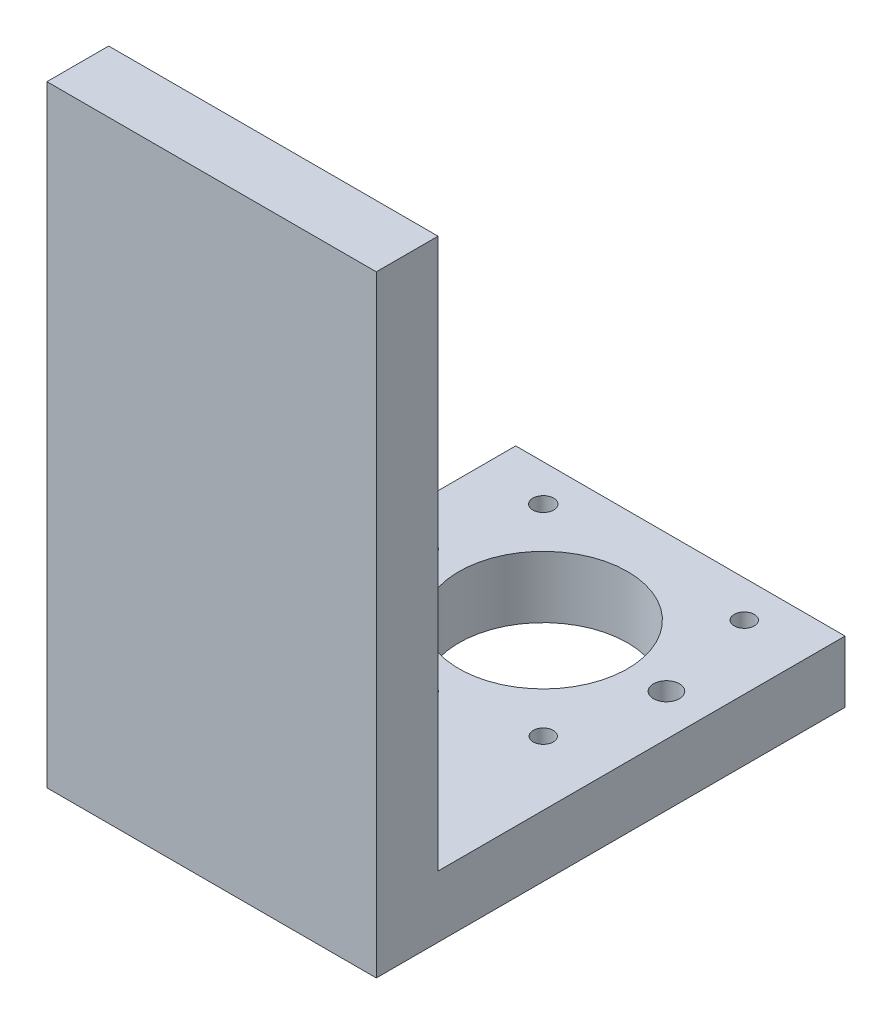
from build123d import *

# Parameters (mm, degrees)
CROQUIS1_W              = 50.8
CROQUIS1_H              = 85
SALIENTE_EXTRUIR1_DEPTH = 9.525
CROQUIS2_R              = 13
CORTAR_EXTRUIR1_DEPTH   = 51.419595645
CROQUIS3_R              = 1.55
CROQUIS3_R_2            = 1.6
CORTAR_EXTRUIR2_DEPTH   = 51.419595645
CROQUIS4_R              = 2
CORTAR_EXTRUIR3_DEPTH   = 51.419595645
CROQUIS5_W              = 50.8
CROQUIS5_H              = 12.7
CORTAR_EXTRUIR4_DEPTH   = 51.419595645
CROQUIS6_W              = 50.8
CROQUIS6_H              = 9.525
SALIENTE_EXTRUIR2_DEPTH = 84.8


with BuildPart() as part:
    # Croquis1 → Saliente-Extruir1 (new body)
    with BuildSketch(Plane(origin=(0, 0, 0), x_dir=(1, 0, 0), z_dir=(0, 1, 0))):
        Rectangle(CROQUIS1_W, CROQUIS1_H)
    extrude(amount=SALIENTE_EXTRUIR1_DEPTH)

    # Croquis2 → Cortar-Extruir1 (cut, through all)
    with BuildSketch(Plane.XZ):
        with Locations(Location((0, -21.35, 0), (0, 0, 270))):
            Circle(CROQUIS2_R)
    extrude(amount=-CORTAR_EXTRUIR1_DEPTH, mode=Mode.SUBTRACT)

    # Croquis3 → Cortar-Extruir2 (cut, through all)
    with BuildSketch(Plane.XZ):
        with Locations(Location((-15.5, -5.85, 0), (0, 0, 270))):
            Circle(CROQUIS3_R)
        with Locations(Location((15.5, -5.85, 0), (0, 0, 270))):
            Circle(CROQUIS3_R)
        with Locations(Location((15.5, -36.85, 0), (0, 0, 270))):
            Circle(CROQUIS3_R)
        with Locations(Location((-15.5, -36.85, 0), (0, 0, 270))):
            Circle(CROQUIS3_R_2)
    extrude(amount=-CORTAR_EXTRUIR2_DEPTH, mode=Mode.SUBTRACT)

    # Croquis4 → Cortar-Extruir3 (cut, through all)
    with BuildSketch(Plane(origin=(0, 9.525, 0), x_dir=(1, 0, 0), z_dir=(0, 1, 0))):
        with Locations(Location((-19, 21.35, 0), (0, 0, 270))):
            Circle(CROQUIS4_R)
        with Locations(Location((19, 21.35, 0), (0, 0, 270))):
            Circle(CROQUIS4_R)
        with Locations(Location((0, 2.35, 0), (0, 0, 270))):
            Circle(CROQUIS4_R)
    extrude(amount=-CORTAR_EXTRUIR3_DEPTH, mode=Mode.SUBTRACT)

    # Croquis5 → Cortar-Extruir4 (cut, through all)
    with BuildSketch(Plane(origin=(0, 9.525, 0), x_dir=(1, 0, 0), z_dir=(0, 1, 0))):
        with Locations((0, -36.15)):
            Rectangle(CROQUIS5_W, CROQUIS5_H)
    extrude(amount=-CORTAR_EXTRUIR4_DEPTH, mode=Mode.SUBTRACT)

    # Croquis6 → Saliente-Extruir2 (add)
    with BuildSketch(Plane(origin=(0, 9.525, 0), x_dir=(1, 0, 0), z_dir=(0, 1, 0))):
        with Locations((0, -25.0375)):
            Rectangle(CROQUIS6_W, CROQUIS6_H)
    extrude(amount=SALIENTE_EXTRUIR2_DEPTH)


solid = part.part
